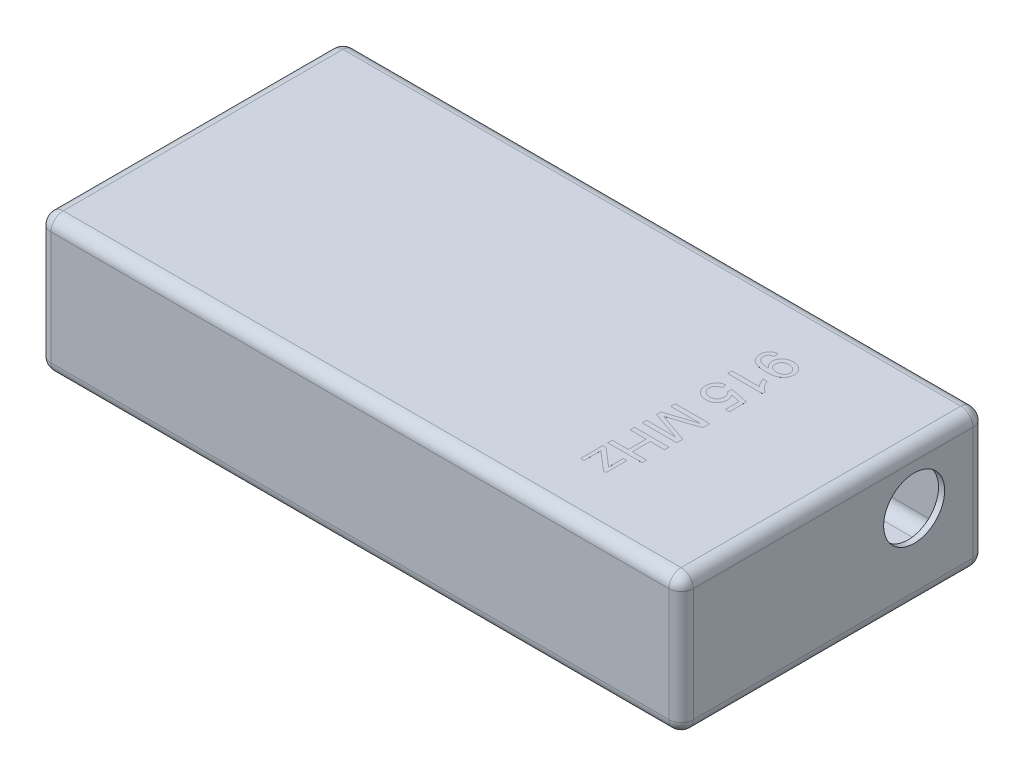
from build123d import *

# Parameters (mm, degrees)
SKETCH2_W           = 53.5178
SKETCH2_H           = 25.3365
BOSS_EXTRUDE1_DEPTH = 5.7404
SHELL1_T            = 0.508
CUT_EXTRUDE1_REACH  = 57.295
SKETCH5_R           = 2.54
BOSS_EXTRUDE2_DEPTH = 0.000254
FILLET1_R           = 1.016


with BuildPart() as part:
    # Sketch2 → Boss-Extrude1 (new, symmetric)
    with BuildSketch(Plane(origin=(0, 0, 0), x_dir=(1, 0, 0), z_dir=(0, 1, 0))):
        Rectangle(SKETCH2_W, SKETCH2_H)
    extrude(amount=BOSS_EXTRUDE1_DEPTH, both=True)

    # Shell1 (no face opened: a closed hollow body)
    add(offset(amount=-SHELL1_T, mode=Mode.PRIVATE), mode=Mode.SUBTRACT)

    # Sketch5 → Cut-Extrude1 (cut, up to next)
    with BuildSketch(Plane(origin=(26.7589, 0, 0), x_dir=(0, 0, -1), z_dir=(1, 0, 0)), mode=Mode.PRIVATE) as cut_extrude1_sk1:
        with Locations((6.75005, 1.3335)):
            Circle(SKETCH5_R)
    cut_extrude1_tool1 = extrude(cut_extrude1_sk1.sketch, amount=-CUT_EXTRUDE1_REACH, mode=Mode.PRIVATE) & part.part
    add(cut_extrude1_tool1.solids().sort_by_distance((26.7589, 1.3335, -6.75005))[0], mode=Mode.SUBTRACT)

    # Sketch7 → Boss-Extrude2 (add)
    # profile 1 of 6: a face of its own
    with BuildSketch(Plane(origin=(0, 5.7404, 0), x_dir=(1, 0, 0), z_dir=(0, 1, 0))):
        with BuildLine():
            add(Edge.make_bspline(
                [(15.021558969, 6.374080519), (14.994437343, 6.391822713), (14.940362453, 6.427196963), (14.868255594, 6.49314269), (14.804167554, 6.567992127), (14.748101802, 6.650891773), (14.703507063, 6.741081078), (14.670493469, 6.835850345), (14.650686948, 6.934719682), (14.648275241, 7.001848452), (14.647058442, 7.035717532)],
                knots=[0, 0, 0, 0, 0.97820481, 1.950337263, 2.940609848, 3.951203215, 4.966707312, 5.972434436, 6.977014144, 8, 8, 8, 8], degree=3))
            add(Edge.make_bspline(
                [(14.647058442, 7.035717532), (14.647795287, 7.064112787), (14.649245781, 7.120009391), (14.662100848, 7.201893636), (14.681507197, 7.28080526), (14.710671309, 7.356067683), (14.746464496, 7.428652621), (14.791474092, 7.497296159), (14.844236198, 7.562729566), (14.904246252, 7.624624637), (14.971177398, 7.680990405), (15.043352217, 7.730717954), (15.120954402, 7.7723704), (15.203647862, 7.806018529), (15.291050364, 7.833152202), (15.383642038, 7.8511594), (15.480757267, 7.863564372), (15.547254883, 7.86457601), (15.581271266, 7.865093506)],
                knots=[0, 0, 0, 0, 0.975038175, 1.919381392, 2.841577404, 3.762083039, 4.686880999, 5.617554557, 6.575999337, 7.571362402, 8.574939696, 9.577785124, 10.577608722, 11.594641491, 12.641237111, 13.716603852, 14.831944903, 16, 16, 16, 16], degree=3))
            add(Edge.make_bspline(
                [(15.581271266, 7.865093506), (15.615863617, 7.864305452), (15.683695762, 7.862760155), (15.783037429, 7.850780304), (15.877691502, 7.831943201), (15.967477913, 7.80446481), (16.052057734, 7.768576394), (16.132548586, 7.726090169), (16.208002044, 7.675235108), (16.277455439, 7.616408862), (16.340667792, 7.552113259), (16.396868801, 7.483157641), (16.443205863, 7.408671265), (16.482293208, 7.33053748), (16.511223092, 7.247175191), (16.532873082, 7.159904906), (16.54600389, 7.067759849), (16.547391842, 7.004891804), (16.5481, 6.972815422)],
                knots=[0, 0, 0, 0, 1.124788497, 2.205597891, 3.24949802, 4.260118073, 5.253389185, 6.233569103, 7.216024167, 8.206380951, 9.188673679, 10.145200569, 11.092934125, 12.036092339, 12.980707788, 13.956219331, 14.957227142, 16, 16, 16, 16], degree=3))
            add(Edge.make_bspline(
                [(16.5481, 6.972815422), (16.547266395, 6.940340339), (16.545620436, 6.876218034), (16.53066422, 6.781829939), (16.505857154, 6.691267404), (16.472785702, 6.603412781), (16.428545714, 6.519589311), (16.375407635, 6.43855505), (16.31162775, 6.361799891), (16.239848839, 6.286841267), (16.154735607, 6.218855608), (16.055707221, 6.159637777), (15.942417803, 6.11045994), (15.815203212, 6.070669829), (15.674104082, 6.03949604), (15.519156583, 6.017190008), (15.350086394, 6.003884316), (15.232810997, 6.002202076), (15.171825122, 6.001327273)],
                knots=[0, 0, 0, 0, 0.819040174, 1.617201236, 2.403899594, 3.185410216, 3.98078521, 4.790572727, 5.626075552, 6.495597872, 7.405261685, 8.365541788, 9.398645895, 10.514135102, 11.724023271, 13.041039272, 14.461273094, 16, 16, 16, 16], degree=3))
            add(Edge.make_bspline(
                [(15.171825122, 6.001327273), (15.109680353, 6.002078582), (14.989146267, 6.003535798), (14.81450113, 6.015606001), (14.652096721, 6.03640392), (14.501826151, 6.065305418), (14.363465899, 6.102270267), (14.237182542, 6.147394412), (14.123011127, 6.201062196), (14.021273304, 6.263444641), (13.931268465, 6.333707116), (13.853441326, 6.411384763), (13.787250809, 6.496155391), (13.733313369, 6.588164379), (13.691660268, 6.687739585), (13.662324843, 6.79421374), (13.6435369, 6.907698048), (13.641612612, 6.985746122), (13.640624675, 7.025816274)],
                knots=[0, 0, 0, 0, 1.431294596, 2.776095051, 4.029614804, 5.20039598, 6.29815686, 7.325097243, 8.2852175, 9.198643443, 10.068149807, 10.909238527, 11.725006833, 12.538725791, 13.358431072, 14.203634575, 15.077739744, 16, 16, 16, 16], degree=3))
            add(Edge.make_bspline(
                [(13.640624675, 7.025816274), (13.641225591, 7.052043934), (13.642408114, 7.103656488), (13.650489605, 7.179473775), (13.664680143, 7.252047787), (13.683635424, 7.321563268), (13.708776645, 7.38769256), (13.739787098, 7.450194695), (13.77625841, 7.509289674), (13.817262365, 7.565424892), (13.864862255, 7.617059928), (13.918363277, 7.66356966), (13.977816243, 7.704634427), (14.042849105, 7.740236524), (14.113696599, 7.770482596), (14.190061803, 7.795498631), (14.272368823, 7.814715977), (14.329371016, 7.823361298), (14.358757102, 7.827818182)],
                knots=[0, 0, 0, 0, 1.053663179, 2.073469322, 3.058563924, 4.021739122, 4.964744887, 5.896066485, 6.820405407, 7.751694344, 8.68454968, 9.635457059, 10.593915359, 11.581784969, 12.608990906, 13.6843696, 14.806233359, 16, 16, 16, 16], degree=3))
            Line((14.358757102, 7.827818182), (14.386131169, 7.455064935))
            add(Edge.make_bspline(
                [(14.386131169, 7.455064935), (14.350952488, 7.448019096), (14.284124817, 7.43463437), (14.192161891, 7.401341535), (14.11411054, 7.358777363), (14.049022235, 7.30698247), (13.999403848, 7.243947837), (13.963798373, 7.171788952), (13.942381913, 7.090316369), (13.94004337, 7.032939146), (13.938827273, 7.003101623)],
                knots=[0, 0, 0, 0, 1.22432938, 2.325814414, 3.326186213, 4.250102235, 5.147061464, 6.042769413, 6.982193494, 8, 8, 8, 8], degree=3))
            add(Edge.make_bspline(
                [(13.938827273, 7.003101623), (13.939729805, 6.977998393), (13.941492403, 6.92897307), (13.95505953, 6.857722499), (13.977978182, 6.791307919), (14.009806317, 6.729225381), (14.051010785, 6.671928785), (14.101081116, 6.618955216), (14.160492002, 6.571222363), (14.228442772, 6.528223286), (14.304183312, 6.48999293), (14.387075938, 6.456904097), (14.476577228, 6.4292519), (14.572341649, 6.405589696), (14.675226757, 6.388661583), (14.784655034, 6.376038773), (14.900860312, 6.367422874), (14.980578729, 6.366819263), (15.021558969, 6.366508969)],
                knots=[0, 0, 0, 0, 0.858695906, 1.676989108, 2.471193468, 3.255639582, 4.05576865, 4.878231697, 5.742563496, 6.656707048, 7.625334835, 8.641922147, 9.70727268, 10.828795471, 12.014968546, 13.27252484, 14.597907609, 16, 16, 16, 16], degree=3))
            Line((15.021558969, 6.366508969), (15.021558969, 6.374080519))
        make_face()
        with BuildLine():
            add(Edge.make_bspline(
                [(14.982536364, 6.946023782), (14.983117095, 6.925999684), (14.984249747, 6.88694495), (14.992472175, 6.829888957), (15.00640357, 6.776174878), (15.026018962, 6.725525914), (15.050050594, 6.677588056), (15.081003572, 6.633417019), (15.117383573, 6.592640069), (15.158582997, 6.554733972), (15.204409548, 6.521472039), (15.253262245, 6.491917719), (15.304964755, 6.467037795), (15.359671419, 6.446370395), (15.417427856, 6.430724204), (15.47807028, 6.419990816), (15.54148379, 6.412550135), (15.584743344, 6.41176033), (15.606898052, 6.411355844)],
                knots=[0, 0, 0, 0, 1.040533688, 2.029443081, 2.988826112, 3.918292611, 4.847923408, 5.768805969, 6.712351565, 7.683652855, 8.672562248, 9.650288974, 10.647656215, 11.650317806, 12.685750808, 13.752519946, 14.848988018, 16, 16, 16, 16], degree=3))
            add(Edge.make_bspline(
                [(15.606898052, 6.411355844), (15.629242753, 6.411793357), (15.673267504, 6.412655367), (15.737734005, 6.41973393), (15.799497299, 6.431355274), (15.858214096, 6.447831441), (15.914687673, 6.467844256), (15.96765104, 6.494113429), (16.018751306, 6.523310966), (16.06554668, 6.558474623), (16.108405706, 6.596652358), (16.146837841, 6.637219606), (16.178358543, 6.68160647), (16.204773805, 6.727891639), (16.2246894, 6.777153061), (16.23938118, 6.828646394), (16.248275014, 6.883008954), (16.249351119, 6.920169935), (16.249897403, 6.939034659)],
                knots=[0, 0, 0, 0, 1.154508542, 2.274675865, 3.34709576, 4.398662372, 5.423860503, 6.438001768, 7.449807731, 8.461165892, 9.456016095, 10.414430195, 11.341667976, 12.262587568, 13.162499027, 14.080352894, 15.025493604, 16, 16, 16, 16], degree=3))
            add(Edge.make_bspline(
                [(16.249897403, 6.939034659), (16.249411896, 6.95810324), (16.248454614, 6.995701056), (16.238634908, 7.050765265), (16.223564972, 7.103814123), (16.201945788, 7.154438094), (16.174104817, 7.202845257), (16.140356928, 7.24880006), (16.100063107, 7.292257214), (16.054662845, 7.333034546), (16.004689519, 7.370190822), (15.951567942, 7.402696871), (15.89632861, 7.431060821), (15.837971079, 7.453079688), (15.777200055, 7.470612476), (15.713723279, 7.483395884), (15.647668886, 7.491172494), (15.602842359, 7.491947286), (15.580106412, 7.49234026)],
                knots=[0, 0, 0, 0, 0.947108096, 1.867427691, 2.771612618, 3.684104755, 4.596341628, 5.542268668, 6.512263996, 7.53744843, 8.572130121, 9.603429975, 10.630747611, 11.654249587, 12.698966528, 13.772229178, 14.870077972, 16, 16, 16, 16], degree=3))
            add(Edge.make_bspline(
                [(15.580106412, 7.49234026), (15.558724314, 7.491970462), (15.516789779, 7.491245215), (15.455455654, 7.483261294), (15.396863069, 7.471359427), (15.341354133, 7.453678841), (15.288712116, 7.431476263), (15.238849437, 7.404827134), (15.192467694, 7.372194911), (15.149439522, 7.335463458), (15.110193119, 7.295134076), (15.075928654, 7.252304943), (15.046797885, 7.206904665), (15.023899637, 7.158951951), (15.004595117, 7.109310432), (14.992256158, 7.05675612), (14.983513704, 7.002230783), (14.982864448, 6.964891972), (14.982536364, 6.946023782)],
                knots=[0, 0, 0, 0, 1.132710122, 2.221469228, 3.272971455, 4.298161562, 5.303481659, 6.298052758, 7.288623045, 8.30322249, 9.292937178, 10.266850791, 11.206058502, 12.144927902, 13.079558083, 14.022984446, 15.000967013, 16, 16, 16, 16], degree=3))
        make_face(mode=Mode.SUBTRACT)
    # profile 2 of 6: a face of its own
    with BuildSketch(Plane(origin=(0, 5.7404, 0), x_dir=(1, 0, 0), z_dir=(0, 1, 0))):
        with BuildLine():
            Line((13.6779, 4.286662338), (13.6779, 4.659415584))
            Line((13.6779, 4.659415584), (15.951694805, 4.659415584))
            add(Edge.make_bspline(
                [(15.951694805, 4.659415584), (15.931611552, 4.68228757), (15.890871543, 4.728684678), (15.834118673, 4.803668774), (15.778716672, 4.883465497), (15.72785645, 4.970153643), (15.676223672, 5.060839292), (15.629163631, 5.158302263), (15.583429283, 5.26075856), (15.55574604, 5.33161095), (15.541666234, 5.367646753)],
                knots=[0, 0, 0, 0, 0.887239177, 1.799814573, 2.740352259, 3.71797783, 4.729118784, 5.782297193, 6.872067659, 8, 8, 8, 8], degree=3))
            Line((15.541666234, 5.367646753), (15.877144156, 5.367646753))
            add(Edge.make_bspline(
                [(15.877144156, 5.367646753), (15.900970397, 5.317041435), (15.947390914, 5.21844741), (16.025716294, 5.079892134), (16.107744956, 4.953280163), (16.194517731, 4.839676461), (16.285002134, 4.73790282), (16.380114076, 4.649196751), (16.479353767, 4.572089735), (16.550330705, 4.530733691), (16.585375325, 4.510314286)],
                knots=[0, 0, 0, 0, 1.186256745, 2.31117662, 3.373566154, 4.384317168, 5.340991231, 6.258927164, 7.140351252, 8, 8, 8, 8], degree=3))
            Line((16.585375325, 4.510314286), (16.585375325, 4.286662338))
            Line((16.585375325, 4.286662338), (13.6779, 4.286662338))
        make_face()
    # profile 3 of 6: a face of its own
    with BuildSketch(Plane(origin=(0, 5.7404, 0), x_dir=(1, 0, 0), z_dir=(0, 1, 0))):
        with BuildLine():
            add(Edge.make_bspline(
                [(15.391400081, 2.90456319), (15.406249447, 2.883202942), (15.435604535, 2.840976763), (15.473899459, 2.775435097), (15.50615484, 2.708941055), (15.533107978, 2.642332549), (15.553680446, 2.574677558), (15.568097798, 2.506665357), (15.577304005, 2.43790249), (15.578393949, 2.39186204), (15.578941558, 2.368730398)],
                knots=[0, 0, 0, 0, 1.081139719, 2.137259754, 3.151507516, 4.151104245, 5.121238668, 6.08679696, 7.038768556, 8, 8, 8, 8], degree=3))
            add(Edge.make_bspline(
                [(15.578941558, 2.368730398), (15.578128979, 2.339765235), (15.576524424, 2.282569326), (15.564616863, 2.19805879), (15.54483725, 2.116543757), (15.51726879, 2.03765183), (15.481496627, 1.961893276), (15.438273296, 1.888576087), (15.386565361, 1.818692493), (15.32832599, 1.752036778), (15.2632484, 1.690809038), (15.192237021, 1.63719923), (15.115708549, 1.59173361), (15.033779642, 1.555428924), (14.94703537, 1.525627889), (14.854735056, 1.505855821), (14.757298038, 1.493155765), (14.690588304, 1.491739365), (14.656377273, 1.491012987)],
                knots=[0, 0, 0, 0, 0.976608671, 1.928455283, 2.871706555, 3.801431924, 4.741610671, 5.692668855, 6.666948445, 7.669033621, 8.674172673, 9.67458817, 10.66382212, 11.668961171, 12.691750237, 13.751284551, 14.846781865, 16, 16, 16, 16], degree=3))
            add(Edge.make_bspline(
                [(14.656377273, 1.491012987), (14.621775497, 1.491715224), (14.553491936, 1.493101027), (14.453173181, 1.506511682), (14.356676938, 1.526950885), (14.264491518, 1.557391583), (14.175778191, 1.594767868), (14.091571169, 1.641934233), (14.011243154, 1.697085109), (13.935475802, 1.759939146), (13.86653918, 1.829951596), (13.80584925, 1.905754881), (13.754396051, 1.986691211), (13.712842253, 2.073425357), (13.679839226, 2.165042051), (13.657751704, 2.262291696), (13.643054677, 2.364400453), (13.641447372, 2.434296514), (13.640624675, 2.470072687)],
                knots=[0, 0, 0, 0, 1.051081258, 2.074216389, 3.070683802, 4.044695066, 5.020117179, 5.992088926, 6.972424138, 7.977951718, 8.979315891, 9.953327156, 10.924026513, 11.887255033, 12.870781218, 13.876914521, 14.91330255, 16, 16, 16, 16], degree=3))
            add(Edge.make_bspline(
                [(13.640624675, 2.470072687), (13.64112427, 2.499413713), (13.642109544, 2.557278421), (13.651715125, 2.642582035), (13.667315202, 2.724998826), (13.689523314, 2.804238492), (13.717683086, 2.880619976), (13.751857782, 2.954064902), (13.793114716, 3.02408829), (13.839373933, 3.09121237), (13.892074569, 3.153637394), (13.951671784, 3.209219985), (14.017680488, 3.257153476), (14.088987311, 3.298780727), (14.166529897, 3.333263899), (14.250028346, 3.360608018), (14.33984405, 3.380399421), (14.401971427, 3.388098859), (14.433890179, 3.392054545)],
                knots=[0, 0, 0, 0, 1.043427689, 2.057788953, 3.049274634, 4.024511315, 4.981580424, 5.942454498, 6.901912801, 7.869415718, 8.839503407, 9.802162849, 10.760825415, 11.735695212, 12.734251468, 13.773832236, 14.856277227, 16, 16, 16, 16], degree=3))
            Line((14.433890179, 3.392054545), (14.460681818, 3.019301299))
            add(Edge.make_bspline(
                [(14.460681818, 3.019301299), (14.439465489, 3.015284747), (14.398117512, 3.007456989), (14.338495782, 2.991749722), (14.282930829, 2.972626528), (14.231622367, 2.949783287), (14.184283872, 2.924379137), (14.141268949, 2.895405819), (14.102026013, 2.863654498), (14.067785532, 2.827802006), (14.037492062, 2.789916354), (14.010765181, 2.749976762), (13.988994502, 2.707588503), (13.970635434, 2.663195028), (13.955912573, 2.616900435), (13.946437604, 2.568013684), (13.939440639, 2.51725682), (13.939034272, 2.4825236), (13.938827273, 2.464830844)],
                knots=[0, 0, 0, 0, 1.234936094, 2.406736187, 3.523622319, 4.592603686, 5.616321435, 6.592742568, 7.55542494, 8.497908931, 9.422357393, 10.327934824, 11.241917494, 12.143194492, 13.074024955, 14.014937265, 14.988828806, 16, 16, 16, 16], degree=3))
            add(Edge.make_bspline(
                [(13.938827273, 2.464830844), (13.93930253, 2.443046991), (13.940236419, 2.400241331), (13.950098088, 2.337666074), (13.964664287, 2.278056392), (13.986979175, 2.222091213), (14.013992622, 2.168758325), (14.048410408, 2.119138906), (14.087990526, 2.072067917), (14.134116915, 2.029622659), (14.18390401, 1.990404863), (14.237602072, 1.956876175), (14.293807754, 1.927918375), (14.352903933, 1.90497108), (14.414414011, 1.885634058), (14.479160746, 1.873594939), (14.54644008, 1.864682079), (14.592278457, 1.864075132), (14.615607386, 1.863766234)],
                knots=[0, 0, 0, 0, 1.031438393, 2.026794852, 2.995212756, 3.933172687, 4.875454207, 5.822171705, 6.788139243, 7.784005793, 8.78698637, 9.787558928, 10.779166706, 11.778596599, 12.788473484, 13.829550171, 14.895373859, 16, 16, 16, 16], degree=3))
            add(Edge.make_bspline(
                [(14.615607386, 1.863766234), (14.639307552, 1.864413324), (14.685471469, 1.865673748), (14.752821638, 1.872913031), (14.816017181, 1.886721386), (14.875931093, 1.904441559), (14.931854366, 1.928245117), (14.983450549, 1.957890939), (15.031878259, 1.991702199), (15.075712015, 2.031316908), (15.115315406, 2.074695929), (15.149410632, 2.121957347), (15.178370174, 2.171936867), (15.202868387, 2.224772734), (15.220408335, 2.28111076), (15.234228451, 2.340012131), (15.241531014, 2.402136014), (15.242810974, 2.444429752), (15.243463636, 2.465995698)],
                knots=[0, 0, 0, 0, 1.160334483, 2.260135429, 3.309470597, 4.32255041, 5.314552111, 6.27637194, 7.230840172, 8.199955832, 9.16201036, 10.101026002, 11.046367635, 11.986200377, 12.944869696, 13.929240678, 14.944101731, 16, 16, 16, 16], degree=3))
            add(Edge.make_bspline(
                [(15.243463636, 2.465995698), (15.242732083, 2.493225294), (15.241308131, 2.546227118), (15.228742425, 2.623241537), (15.208453643, 2.695464585), (15.179683337, 2.762993425), (15.142888689, 2.825815683), (15.097316719, 2.883258029), (15.044266209, 2.936363048), (15.003354947, 2.966240008), (14.982536364, 2.981443547)],
                knots=[0, 0, 0, 0, 1.083335722, 2.10868976, 3.09702626, 4.063114393, 5.022751115, 5.985960064, 6.975112085, 8, 8, 8, 8], degree=3))
            Line((14.982536364, 2.981443547), (15.022141396, 3.317503896))
            Line((15.022141396, 3.317503896), (16.510824675, 3.03619168))
            Line((16.510824675, 3.03619168), (16.510824675, 1.602838961))
            Line((16.510824675, 1.602838961), (16.175346753, 1.602838961))
            Line((16.175346753, 1.602838961), (16.175346753, 2.756044318))
            Line((16.175346753, 2.756044318), (15.391400081, 2.90456319))
        make_face()
    # profile 4 of 6: a face of its own
    with BuildSketch(Plane(origin=(0, 5.7404, 0), x_dir=(1, 0, 0), z_dir=(0, 1, 0))):
        with BuildLine():
            Line((13.6779, -2.832924675), (13.6779, -2.460171429))
            Line((13.6779, -2.460171429), (16.078081453, -2.460171429))
            Line((16.078081453, -2.460171429), (16.078081453, -2.452599878))
            Line((16.078081453, -2.452599878), (13.6779, -1.63545487))
            Line((13.6779, -1.63545487), (13.6779, -1.259207062))
            Line((13.6779, -1.259207062), (16.117686485, -0.458952435))
            Line((16.117686485, -0.458952435), (16.117686485, -0.447303896))
            Line((16.117686485, -0.447303896), (13.6779, -0.447303896))
            Line((13.6779, -0.447303896), (13.6779, -0.074550649))
            Line((13.6779, -0.074550649), (16.5481, -0.074550649))
            Line((16.5481, -0.074550649), (16.5481, -0.655230317))
            Line((16.5481, -0.655230317), (14.517177232, -1.333757711))
            add(Edge.make_bspline(
                [(14.517177232, -1.333757711), (14.490396764, -1.34272248), (14.439397157, -1.359794611), (14.366565895, -1.383586484), (14.301664381, -1.404807298), (14.244319987, -1.421801099), (14.195522229, -1.437643046), (14.154074553, -1.448669448), (14.120966228, -1.458709815), (14.10115613, -1.462963846), (14.092587987, -1.464803774)],
                knots=[0, 0, 0, 0, 1.524848669, 2.903858185, 4.137067959, 5.211419151, 6.133172737, 6.90640199, 7.527003638, 8, 8, 8, 8], degree=3))
            Line((14.092587987, -1.464803774), (14.092587987, -1.472375325))
            add(Edge.make_bspline(
                [(14.092587987, -1.472375325), (14.107158135, -1.477005513), (14.13770173, -1.486711839), (14.185193964, -1.502467769), (14.236592822, -1.519505088), (14.292159592, -1.537241255), (14.351316494, -1.55798459), (14.4148274, -1.579456484), (14.482335522, -1.601951117), (14.528453989, -1.617933553), (14.552122849, -1.626136039)],
                knots=[0, 0, 0, 0, 0.757162084, 1.58724897, 2.478147294, 3.438993264, 4.475874888, 5.582666684, 6.759379292, 8, 8, 8, 8], degree=3))
            Line((14.552122849, -1.626136039), (16.5481, -2.315729545))
            Line((16.5481, -2.315729545), (16.5481, -2.832924675))
            Line((16.5481, -2.832924675), (13.6779, -2.832924675))
        make_face()
    # profile 5 of 6: a face of its own
    with BuildSketch(Plane(origin=(0, 5.7404, 0), x_dir=(1, 0, 0), z_dir=(0, 1, 0))):
        Polygon((13.6779, -5.703124675), (13.6779, -5.330371429), (15.019811688, -5.330371429), (15.019811688, -3.839358442), (13.6779, -3.839358442), (13.6779, -3.466605195), (16.5481, -3.466605195), (16.5481, -3.839358442), (15.35528961, -3.839358442), (15.35528961, -5.330371429), (16.5481, -5.330371429), (16.5481, -5.703124675), align=None)
    # profile 6 of 6: a face of its own
    with BuildSketch(Plane(origin=(0, 5.7404, 0), x_dir=(1, 0, 0), z_dir=(0, 1, 0))):
        with BuildLine():
            Line((13.6779, -7.976919481), (13.6779, -6.113153247))
            Line((13.6779, -6.113153247), (13.955135227, -6.113153247))
            Line((13.955135227, -6.113153247), (15.480511404, -7.427108442))
            add(Edge.make_bspline(
                [(15.480511404, -7.427108442), (15.478446768, -7.389838535), (15.474479887, -7.318230118), (15.470735753, -7.215116496), (15.467207927, -7.120775368), (15.467145348, -7.060764873), (15.467115584, -7.032222971)],
                knots=[0, 0, 0, 0, 1.133477667, 2.177803728, 3.133335774, 4, 4, 4, 4], degree=3))
            Line((15.467115584, -7.032222971), (15.467115584, -6.187703896))
            Line((15.467115584, -6.187703896), (15.765318182, -6.187703896))
            Line((15.765318182, -6.187703896), (15.765318182, -7.902368831))
            Line((15.765318182, -7.902368831), (15.529435268, -7.902368831))
            Line((15.529435268, -7.902368831), (14.204996388, -6.768383563))
            add(Edge.make_bspline(
                [(14.204996388, -6.768383563), (14.20088268, -6.765126403), (14.191483721, -6.757684477), (14.176380227, -6.743786845), (14.157111056, -6.72738891), (14.135214057, -6.706504533), (14.108947944, -6.683701964), (14.079502727, -6.657031392), (14.046704235, -6.627120217), (14.023658123, -6.60589665), (14.011630641, -6.594820333)],
                knots=[0, 0, 0, 0, 0.484444208, 1.106853205, 1.894553471, 2.820864052, 3.900398098, 5.106521183, 6.489929172, 8, 8, 8, 8], degree=3))
            add(Edge.make_bspline(
                [(14.011630641, -6.594820333), (14.002327949, -6.584822761), (13.986351986, -6.567653446), (13.966797736, -6.554771789), (13.958629789, -6.549391031)],
                knots=[0, 0, 0, 0, 1.164585993, 2, 2, 2, 2], degree=3))
            add(Edge.make_bspline(
                [(13.958629789, -6.549391031), (13.96127275, -6.584328059), (13.966687481, -6.655904846), (13.972699555, -6.765990827), (13.975260273, -6.88136192), (13.975817719, -6.960001349), (13.976102597, -7.000189489)],
                knots=[0, 0, 0, 0, 0.931685289, 1.908778238, 2.931295491, 4, 4, 4, 4], degree=3))
            Line((13.976102597, -7.000189489), (13.976102597, -7.976919481))
            Line((13.976102597, -7.976919481), (13.6779, -7.976919481))
        make_face()
    extrude(amount=BOSS_EXTRUDE2_DEPTH)

    # Fillet1
    fillet1_edges = [part.edges().sort_by_distance(p)[0] for p in [
        (-26.7589, 5.7404, 0),
        (0, 5.7404, 12.66825),
        (26.2509, -5.2324, 0),
        (26.2509, 0, 12.16025),
        (0, -5.2324, -12.16025),
        (26.2509, 0, -12.16025),
        (-26.2509, -5.2324, 0),
        (0, -5.2324, 12.16025),
        (26.2509, 5.2324, 0),
        (0, 5.2324, -12.16025),
        (-26.2509, 5.2324, 0),
        (0, 5.2324, 12.16025),
        (26.7589, 5.7404, 0),
        (0, -5.7404, 12.66825),
        (-26.7589, -5.7404, 0),
        (0, -5.7404, -12.66825),
        (26.7589, -5.7404, 0),
        (0, 5.7404, -12.66825),
        (26.7589, 0, 12.66825),
        (-26.7589, 0, 12.66825),
        (-26.7589, 0, -12.66825),
        (26.7589, 0, -12.66825),
    ]]
    fillet(fillet1_edges, radius=FILLET1_R)


solid = part.part
